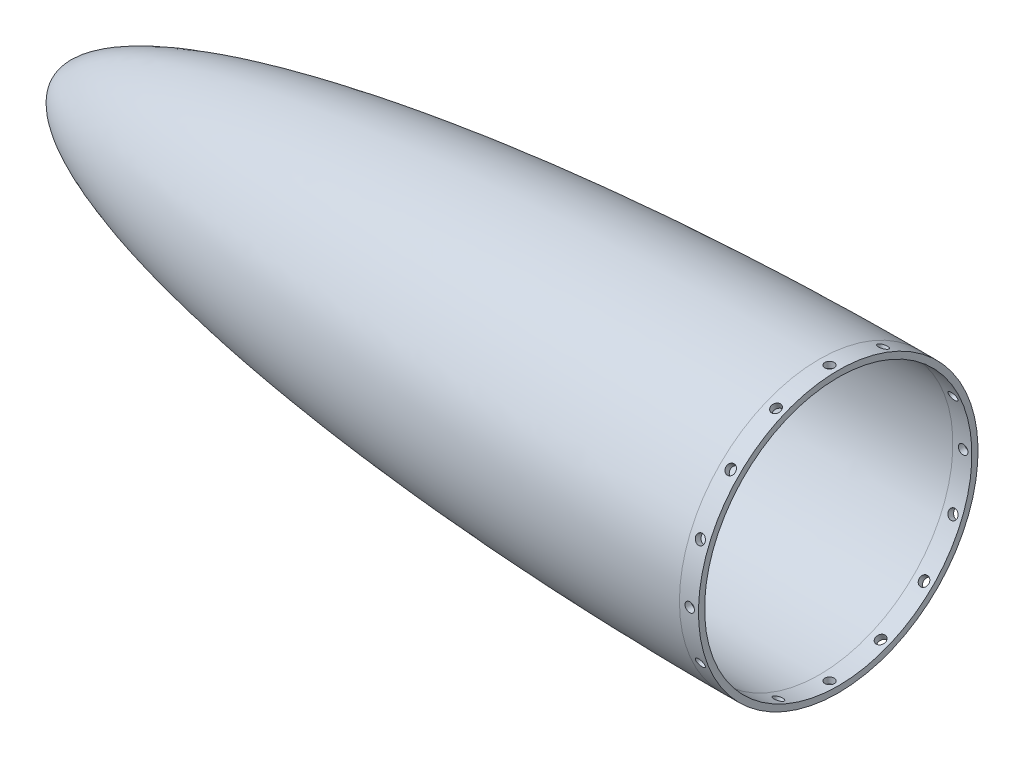
from build123d import *

# Parameters (mm, degrees)
F_6_CLEARANCE_HOLE1_D = 4.3053
CIRPATTERN1_COUNT     = 16


with BuildPart() as part:
    # Sketch1 → Revolve1 (revolve)
    with BuildSketch(Plane.XY, mode=Mode.PRIVATE) as revolve1_sk:
        with BuildLine():
            Line((-345.44, 0), (-342.646, 0))
            add(Edge.make_bspline(
                [(0, 60.706), (-11.269947441, 60.706), (-33.871275386, 60.502123886), (-67.396397607, 59.587694143), (-100.282576704, 58.073486739), (-142.833248447, 55.275010323), (-192.818444485, 50.363691822), (-245.343387991, 42.438922632), (-281.186370536, 34.406950746), (-304.241065772, 27.334094043), (-318.539081514, 21.774331976), (-329.672161573, 16.048105338), (-336.176254289, 11.253593881), (-339.666824523, 7.542766546), (-341.444454091, 4.879793774), (-342.438386413, 2.365362627), (-342.646, 0.80529583), (-342.646, 0)],
                knots=[-1.570796327, -1.570796327, -1.570796327, -1.570796327, -1.472621556, -1.374446786, -1.276272016, -1.178097245, -0.981747704, -0.785398163, -0.589048623, -0.490873852, -0.392699082, -0.294524311, -0.196349541, -0.147262156, -0.09817477, -0.049087385, 0, 0, 0, 0], degree=3))
            Line((0, 60.706), (8.636, 60.706))
            Line((8.636, 60.706), (8.636, 63.5))
            Line((8.636, 63.5), (0, 63.5))
            add(Edge.make_bspline(
                [(0, 63.5), (-345.44, 63.5), (-345.44, 0)],
                knots=[4.71238898, 4.71238898, 4.71238898, 6.283185307, 6.283185307, 6.283185307], degree=2, weights=[1, 0.707106781, 1]))
        make_face()
    revolve(revolve1_sk.sketch.rotate(Axis((-92, 0, 0), (1, 0, 0)), 180), axis=Axis((-92, 0, 0), (1, 0, 0)))

    # #6 Clearance Hole1 (through all)
    with Locations(Plane(origin=(4.6736, 63.5, 0), x_dir=(1, 0, 0), z_dir=(0, 1, 0))):
        with Locations((0, 0)):
            f_6_clearance_hole1 = Hole(F_6_CLEARANCE_HOLE1_D / 2)

    # CirPattern1: #6 Clearance Hole1 ×16 about axis
    cirpattern1_axis = Axis((8.636, 0, 0), (-1, 0, 0))
    for i in range(1, CIRPATTERN1_COUNT):
        add(f_6_clearance_hole1.rotate(cirpattern1_axis, i * 360 / CIRPATTERN1_COUNT), mode=Mode.SUBTRACT)


solid = part.part
